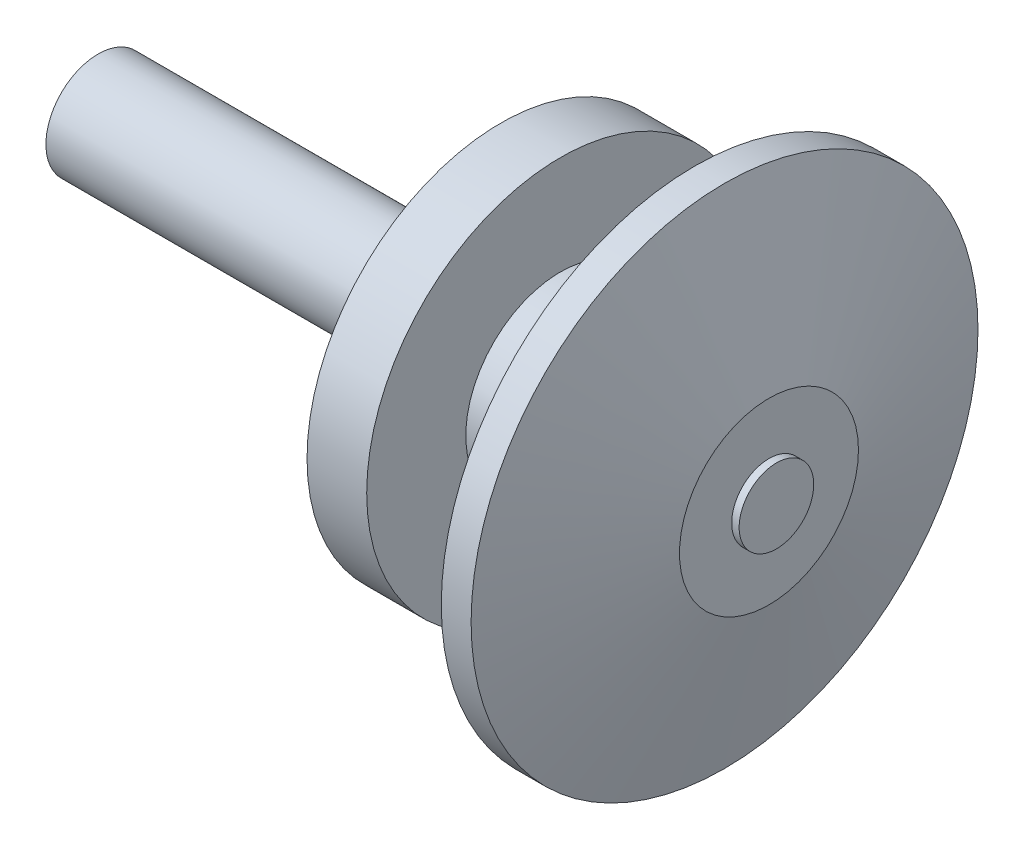
from build123d import *


with BuildPart() as part:
    # Sketch1 → Revolve1 (revolve)
    with BuildSketch(Plane.XY):
        Polygon((-22.4892, 1.75), (-8.9892, 1.75), (-8.9892, 6.4963), (-6.9892, 6.4963), (-6.9892, 3.175), (-2.4892, 3.175), (-2.4892, 8.4963), (-1.4892, 8.4963), (0, 3), (0, 1.25), (0.25, 1.25), (0.25, 0), (-22.4892, 0), align=None)
    revolve(axis=Axis((-22.4892, 0, 0), (-1, 0, 0)))


solid = part.part
